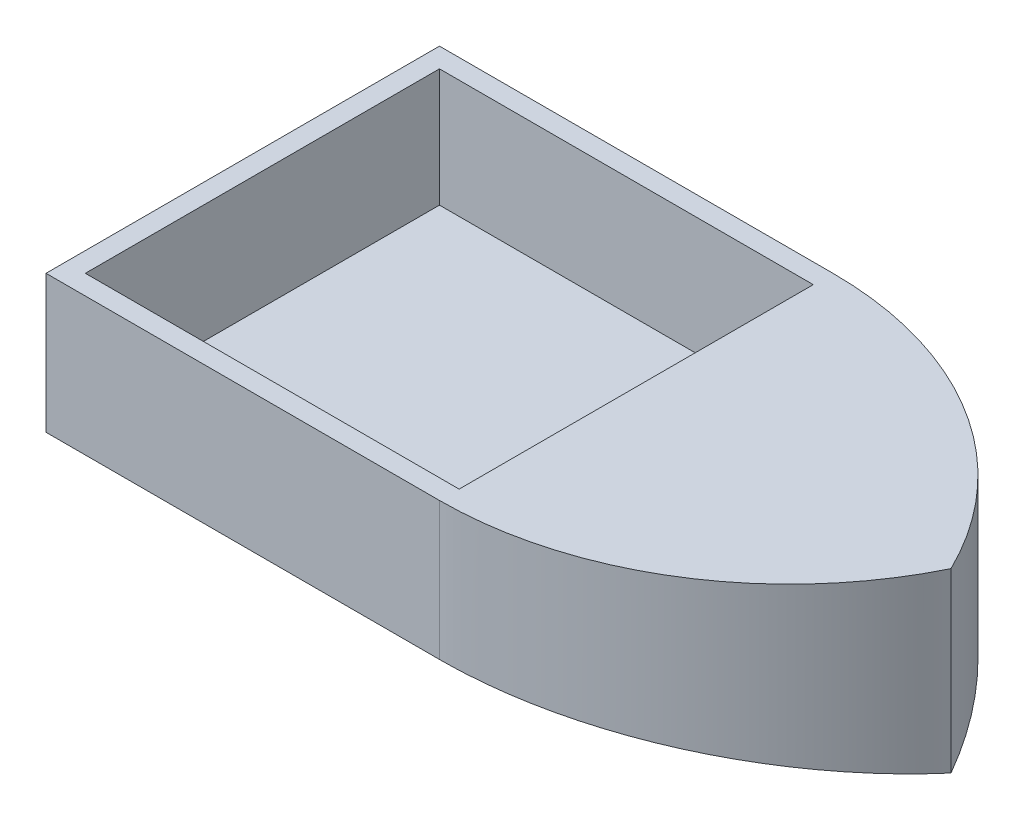
from build123d import *

# Parameters (mm, degrees)
BOSS_EXTRUDE1_DEPTH = 90
CUT_EXTRUDE1_DEPTH  = 385.317577012
SHELL3_T            = -10
BOSS_EXTRUDE2_START = -10
BOSS_EXTRUDE2_DEPTH = 10
SKETCH9_W           = 180
SKETCH9_H           = 60
BOSS_EXTRUDE3_DEPTH = 220
SKETCH9_4_W         = 180
SKETCH9_4_H         = 60
CUT_EXTRUDE3_DEPTH  = 200
SKETCH9_5_W         = 180
SKETCH9_5_H         = 60
BOSS_EXTRUDE5_DEPTH = 10
SKETCH10_W          = 190
SKETCH10_H          = 180
BOSS_EXTRUDE6_DEPTH = 70
SKETCH10_2_W        = 190
SKETCH10_2_H        = 180
CUT_EXTRUDE4_DEPTH  = 30
SKETCH10_3_W        = 190
SKETCH10_3_H        = 180
CUT_EXTRUDE5_DEPTH  = 50
SKETCH10_4_W        = 190
SKETCH10_4_H        = 180
CUT_EXTRUDE6_DEPTH  = 60


with BuildPart() as part:
    # Sketch1 → Boss-Extrude1 (new body)
    with BuildSketch(Plane(origin=(0, 0, 0), x_dir=(1, 0, 0), z_dir=(0, 1, 0))):
        with BuildLine():
            Line((0, 100), (0, -100))
            Line((0, -100), (200, -100))
            ThreePointArc((200, -100), (294.339811321, -72.943698113), (360, 0))
            ThreePointArc((360, 0), (294.339811321, 72.943698113), (200, 100))
            Line((200, 100), (0, 100))
        make_face()
    extrude(amount=BOSS_EXTRUDE1_DEPTH)

    # Sketch2 → Cut-Extrude1 (cut, through all)
    with BuildSketch(Plane.ZY):
        Polygon((-100, 0), (0, 0), (-100, 20), align=None)
        Polygon((100, 20), (0, 0), (100, 0), align=None)
    extrude(amount=-CUT_EXTRUDE1_DEPTH, mode=Mode.SUBTRACT)

    # Shell3
    shell3_openings = [part.faces().sort_by_distance(p)[0] for p in [
        (159.417640867, 90, 0),
    ]]
    offset(amount=SHELL3_T, openings=shell3_openings, kind=Kind.INTERSECTION)

    # Sketch6 → Boss-Extrude2 (add)
    with BuildSketch(Plane(origin=(0, 90, 0), x_dir=(1, 0, 0), z_dir=(0, 1, 0)).offset(BOSS_EXTRUDE2_START)):
        with BuildLine():
            Line((200, 90), (200, -90))
            ThreePointArc((200, -90), (286.948260477, -65.749782609), (348.795161212, 0))
            ThreePointArc((348.795161212, 0), (286.948260477, 65.749782609), (200, 90))
        make_face()
    extrude(amount=BOSS_EXTRUDE2_DEPTH)

    # Sketch9 → Boss-Extrude3 (add)
    with BuildSketch(Plane.ZY):
        with Locations((0, 50)):
            Rectangle(SKETCH9_W, SKETCH9_H)
    extrude(amount=-BOSS_EXTRUDE3_DEPTH)

    # Sketch9<4> → Cut-Extrude3 (cut)
    with BuildSketch(Plane.ZY):
        with Locations((0, 50)):
            Rectangle(SKETCH9_4_W, SKETCH9_4_H)
    extrude(amount=-CUT_EXTRUDE3_DEPTH, mode=Mode.SUBTRACT)

    # Sketch9<5> → Boss-Extrude5 (add)
    with BuildSketch(Plane.ZY):
        with Locations((0, 50)):
            Rectangle(SKETCH9_5_W, SKETCH9_5_H)
    extrude(amount=-BOSS_EXTRUDE5_DEPTH)

    # Sketch10 → Boss-Extrude6 (add)
    with BuildSketch(Plane(origin=(0, 90, 0), x_dir=(1, 0, 0), z_dir=(0, 1, 0))):
        with Locations((105, 0)):
            Rectangle(SKETCH10_W, SKETCH10_H)
    extrude(amount=-BOSS_EXTRUDE6_DEPTH)

    # Sketch10<2> → Cut-Extrude4 (cut)
    with BuildSketch(Plane(origin=(0, 90, 0), x_dir=(1, 0, 0), z_dir=(0, 1, 0))):
        with Locations((105, 0)):
            Rectangle(SKETCH10_2_W, SKETCH10_2_H)
    extrude(amount=-CUT_EXTRUDE4_DEPTH, mode=Mode.SUBTRACT)

    # Sketch10<3> → Cut-Extrude5 (cut)
    with BuildSketch(Plane(origin=(0, 90, 0), x_dir=(1, 0, 0), z_dir=(0, 1, 0))):
        with Locations((105, 0)):
            Rectangle(SKETCH10_3_W, SKETCH10_3_H)
    extrude(amount=-CUT_EXTRUDE5_DEPTH, mode=Mode.SUBTRACT)

    # Sketch10<4> → Cut-Extrude6 (cut)
    with BuildSketch(Plane(origin=(0, 90, 0), x_dir=(1, 0, 0), z_dir=(0, 1, 0))):
        with Locations((105, 0)):
            Rectangle(SKETCH10_4_W, SKETCH10_4_H)
    extrude(amount=-CUT_EXTRUDE6_DEPTH, mode=Mode.SUBTRACT)


solid = part.part
